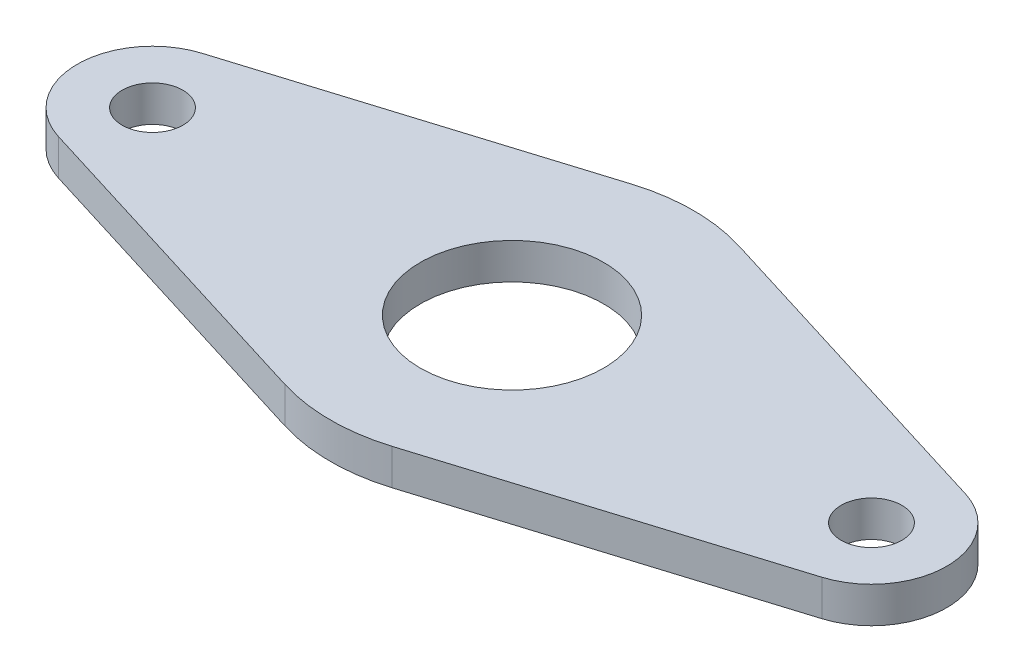
from build123d import *

# Parameters (mm, degrees)
SKETCH1_R           = 5.3213
SKETCH1_R_2         = 2.1463
SKETCH1_R_3         = 12.827
SKETCH1_R_4         = 6.477
BOSS_EXTRUDE1_DEPTH = 2.54


with BuildPart() as part:
    # Sketch1 → Boss-Extrude1 (new body)
    # profile 1 of 5: a face of its own
    with BuildSketch(Plane(origin=(0, 0, 0), x_dir=(1, 0, 0), z_dir=(0, 1, 0))):
        with BuildLine():
            Line((-3.7903785, 12.25418132), (-26.97244415, 5.08366532))
            ThreePointArc((-26.97244415, 5.08366532), (-22.241773707, 4.282737486), (-20.0787, 0))
            ThreePointArc((-20.0787, 0), (-22.241773707, -4.282737486), (-26.97244415, -5.08366532))
            Line((-26.97244415, -5.08366532), (-3.7903785, -12.25418132))
            ThreePointArc((-3.7903785, -12.25418132), (-12.827, 0), (-3.7903785, 12.25418132))
        make_face()
    # profile 2 of 5: a face of its own
    with BuildSketch(Plane(origin=(0, 0, 0), x_dir=(1, 0, 0), z_dir=(0, 1, 0))):
        with Locations((-25.4, 0)):
            Circle(SKETCH1_R)
        with Locations(Location((-25.4, 0, 0), (0, 0, 270))):
            Circle(SKETCH1_R_2, mode=Mode.SUBTRACT)
    # profile 3 of 5: a face of its own
    with BuildSketch(Plane(origin=(0, 0, 0), x_dir=(1, 0, 0), z_dir=(0, 1, 0))):
        Circle(SKETCH1_R_3)
        with Locations(Location((0, 0, 0), (0, 0, 270))):
            Circle(SKETCH1_R_4, mode=Mode.SUBTRACT)
    # profile 4 of 5: a face of its own
    with BuildSketch(Plane(origin=(0, 0, 0), x_dir=(1, 0, 0), z_dir=(0, 1, 0))):
        with BuildLine():
            Line((26.97244415, 5.08366532), (3.7903785, 12.25418132))
            ThreePointArc((3.7903785, 12.25418132), (10.32354382, 7.612908248), (12.827, 0))
            ThreePointArc((12.827, 0), (10.32354382, -7.612908248), (3.7903785, -12.25418132))
            Line((3.7903785, -12.25418132), (26.97244415, -5.08366532))
            ThreePointArc((26.97244415, -5.08366532), (20.0787, 0), (26.97244415, 5.08366532))
        make_face()
    # profile 5 of 5: a face of its own
    with BuildSketch(Plane(origin=(0, 0, 0), x_dir=(1, 0, 0), z_dir=(0, 1, 0))):
        with Locations((25.4, 0)):
            Circle(SKETCH1_R)
        with Locations(Location((25.4, 0, 0), (0, 0, 270))):
            Circle(SKETCH1_R_2, mode=Mode.SUBTRACT)
    extrude(amount=BOSS_EXTRUDE1_DEPTH)


solid = part.part
